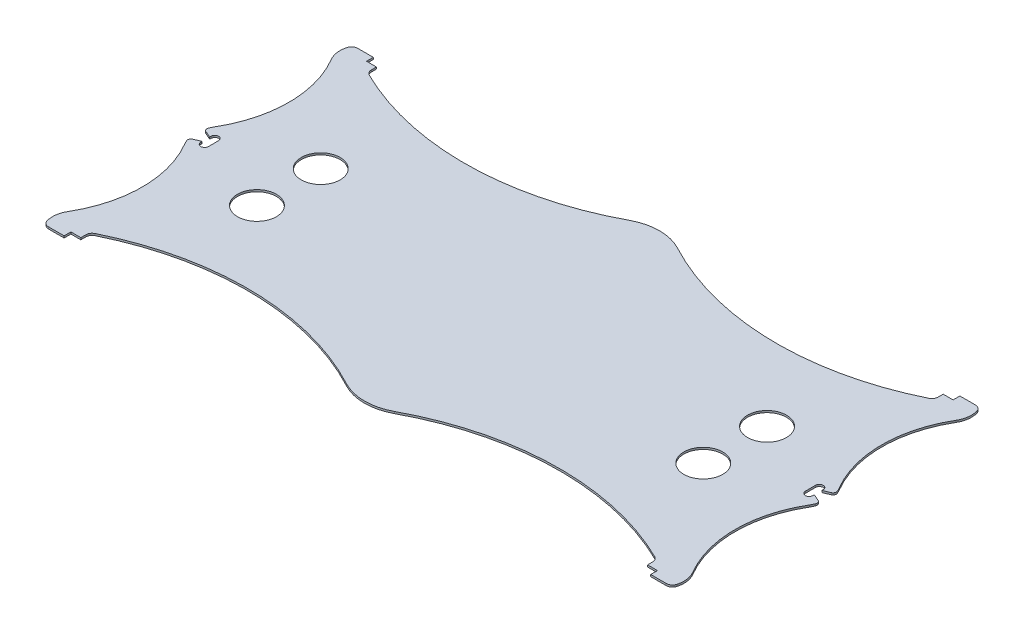
from build123d import *

# Parameters (mm, degrees)
BOSS_EXTRUDE1_DEPTH = 0.3
CUT_EXTRUDE1_DEPTH  = 0.3
SKETCH3_R           = 3.05
CUT_EXTRUDE2_DEPTH  = 10
FILLET3_R           = 0.5


with BuildPart() as part:
    # Sketch1 → Boss-Extrude1 (new body)
    with BuildSketch(Plane(origin=(0, 0, 0), x_dir=(1, 0, 0), z_dir=(0, 1, 0))):
        with BuildLine():
            Line((-46, 24.246517619), (-48.427621072, 24.246517619))
            ThreePointArc((-48.427621072, 24.246517619), (-49.0377529, 24.038817532), (-49.394435861, 23.501995922))
            ThreePointArc((-49.394435861, 23.501995922), (-49.48304753, 22.03719771), (-49, 20.651502609))
            ThreePointArc((-49, 20.651502609), (-46.5, 11.5), (-49, 2.348497391))
            ThreePointArc((-49, 2.348497391), (-49.641560597, 0), (-49, -2.348497391))
            ThreePointArc((-49, -2.348497391), (-46.5, -11.5), (-49, -20.651502609))
            ThreePointArc((-49, -20.651502609), (-49.48304753, -22.03719771), (-49.394435861, -23.501995922))
            ThreePointArc((-49.394435861, -23.501995922), (-49.0377529, -24.038817532), (-48.427621072, -24.246517619))
            Line((-48.427621072, -24.246517619), (-46, -24.246517619))
            Line((-46, -24.246517619), (-46, -23.179169783))
            Line((-46, -23.179169783), (-44.447028528, -23.179169783))
            Line((-44.447028528, -23.179169783), (-44.447028528, -22.399350913))
            ThreePointArc((-44.447028528, -22.399350913), (-44.29574184, -21.870497705), (-43.887657098, -21.501661399))
            ThreePointArc((-43.887657098, -21.501661399), (-23.745443606, -17.006470423), (-3.769230769, -22.189753839))
            ThreePointArc((-3.769230769, -22.189753839), (0, -23.133345446), (3.769230769, -22.189753839))
            ThreePointArc((3.769230769, -22.189753839), (23.745443606, -17.006470423), (43.887657098, -21.501661399))
            ThreePointArc((43.887657098, -21.501661399), (44.29574184, -21.870497705), (44.447028528, -22.399350913))
            Line((44.447028528, -22.399350913), (44.447028528, -23.179169783))
            Line((44.447028528, -23.179169783), (46, -23.179169783))
            Line((46, -23.179169783), (46, -24.246517619))
            Line((46, -24.246517619), (48.427621072, -24.246517619))
            ThreePointArc((48.427621072, -24.246517619), (49.0377529, -24.038817532), (49.394435861, -23.501995922))
            ThreePointArc((49.394435861, -23.501995922), (49.48304753, -22.03719771), (49, -20.651502609))
            ThreePointArc((49, -20.651502609), (46.5, -11.5), (49, -2.348497391))
            ThreePointArc((49, -2.348497391), (49.641560597, 0), (49, 2.348497391))
            ThreePointArc((49, 2.348497391), (46.5, 11.5), (49, 20.651502609))
            ThreePointArc((49, 20.651502609), (49.48304753, 22.03719771), (49.394435861, 23.501995922))
            ThreePointArc((49.394435861, 23.501995922), (49.0377529, 24.038817532), (48.427621072, 24.246517619))
            Line((48.427621072, 24.246517619), (46, 24.246517619))
            Line((46, 24.246517619), (46, 23.179169783))
            Line((46, 23.179169783), (44.447028528, 23.179169783))
            Line((44.447028528, 23.179169783), (44.447028528, 22.399350913))
            ThreePointArc((44.447028528, 22.399350913), (44.29574184, 21.870497705), (43.887657098, 21.501661399))
            ThreePointArc((43.887657098, 21.501661399), (23.745443606, 17.006470423), (3.769230769, 22.189753839))
            ThreePointArc((3.769230769, 22.189753839), (0, 23.133345446), (-3.769230769, 22.189753839))
            ThreePointArc((-3.769230769, 22.189753839), (-23.745443606, 17.006470423), (-43.887657098, 21.501661399))
            ThreePointArc((-43.887657098, 21.501661399), (-44.29574184, 21.870497705), (-44.447028528, 22.399350913))
            Line((-44.447028528, 22.399350913), (-44.447028528, 23.179169783))
            Line((-44.447028528, 23.179169783), (-46, 23.179169783))
            Line((-46, 23.179169783), (-46, 24.246517619))
        make_face()
    extrude(amount=BOSS_EXTRUDE1_DEPTH)

    # Sketch2 → Cut-Extrude1 (cut)
    with BuildSketch(Plane(origin=(0, 0.3, 0), x_dir=(1, 0, 0), z_dir=(0, 1, 0))):
        with BuildLine():
            Line((48.008247744, 0.595828641), (51.16087761, 1.941605447))
            Line((51.16087761, 1.941605447), (51.16087761, -1.941605447))
            Line((51.16087761, -1.941605447), (48.008247744, -0.595828641))
            Line((48.008247744, -0.595828641), (48.008247744, -0.8))
            ThreePointArc((48.008247744, -0.8), (47.408247744, -1.4), (46.808247744, -0.8))
            Line((46.808247744, -0.8), (46.808247744, 0.8))
            ThreePointArc((46.808247744, 0.8), (47.408247744, 1.4), (48.008247744, 0.8))
            Line((48.008247744, 0.8), (48.008247744, 0.595828641))
        make_face()
    cut_extrude1 = extrude(amount=-CUT_EXTRUDE1_DEPTH, mode=Mode.SUBTRACT)

    # Sketch3 → Cut-Extrude2 (cut)
    with BuildSketch(Plane(origin=(0, 0.3, 0), x_dir=(1, 0, 0), z_dir=(0, 1, 0))):
        with Locations(Location((35, 5, 0), (0, 0, 270))):
            Circle(SKETCH3_R)
        with Locations(Location((35, -5, 0), (0, 0, 90))):
            Circle(SKETCH3_R)
    cut_extrude2 = extrude(amount=-CUT_EXTRUDE2_DEPTH, mode=Mode.SUBTRACT)

    # Mirror2: Cut-Extrude1, Cut-Extrude2 across plane
    add(cut_extrude1.mirror(Plane(origin=(0, 0, 0), x_dir=(0, 0, 1), z_dir=(1, 0, 0))), mode=Mode.SUBTRACT)
    add(cut_extrude2.mirror(Plane(origin=(0, 0, 0), x_dir=(0, 0, 1), z_dir=(1, 0, 0))), mode=Mode.SUBTRACT)

    # Fillet3
    fillet3_edges = [part.edges().sort_by_distance(p)[0] for p in [
        (49.476795577, 0.15, -1.222714034),
        (49.476795577, 0.15, 1.222714034),
        (-49.476795577, 0.15, 1.222714034),
        (-49.476795577, 0.15, -1.222714034),
    ]]
    fillet(fillet3_edges, radius=FILLET3_R)


solid = part.part
